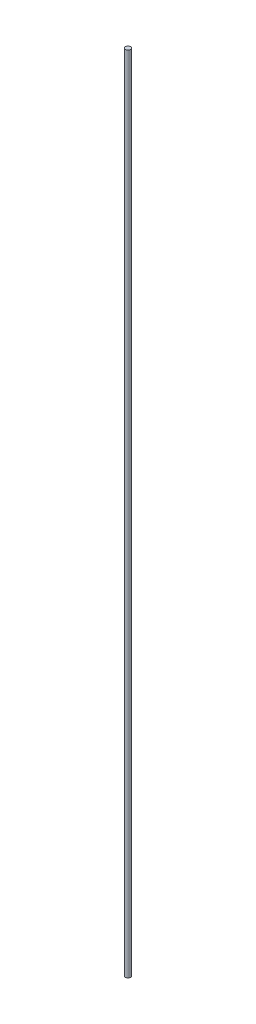
from build123d import *

# Parameters (mm, degrees)
SWEEP1_PROFILE_R = 6.35


with BuildPart() as part:
    # Sweep1: sweep along a path in Sketch1
    with BuildLine(Plane.XY) as sweep1_path:
        Line((0, 0), (0, 1999.996))
    # Sweep1 profile (on start of the path) → Sweep1 (sweep)
    with BuildSketch(Plane.ZX):
        Circle(SWEEP1_PROFILE_R)
    sweep(path=sweep1_path.line)


solid = part.part
